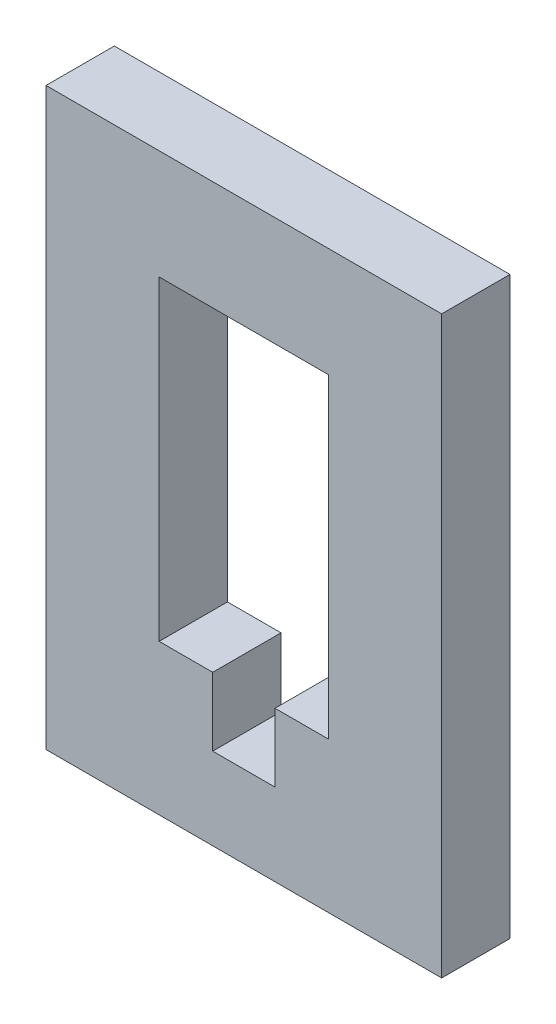
from build123d import *

# Parameters (mm, degrees)
SKETCH1_W           = 28.96
SKETCH1_H           = 11
BOSS_EXTRUDE1_DEPTH = 5
SKETCH2_W           = 8.28
SKETCH2_H           = 5
BOSS_EXTRUDE2_DEPTH = 23.1
SKETCH3_W           = 28.96
SKETCH3_H           = 5
BOSS_EXTRUDE3_DEPTH = 8
SKETCH4_W           = 4.56
SKETCH4_H           = 5
CUT_EXTRUDE1_DEPTH  = 5


with BuildPart() as part:
    # Sketch1 → Boss-Extrude1 (new body)
    with BuildSketch(Plane.XY):
        with Locations((-4.078230088, 25.589734513)):
            Rectangle(SKETCH1_W, SKETCH1_H)
    extrude(amount=BOSS_EXTRUDE1_DEPTH)

    # Sketch2 → Boss-Extrude2 (add)
    with BuildSketch(Plane(origin=(0, 31.089734513, 0), x_dir=(1, 0, 0), z_dir=(0, 1, 0))):
        with Locations((-14.418230088, -2.5)):
            Rectangle(SKETCH2_W, SKETCH2_H)
        with Locations((6.261769912, -2.5)):
            Rectangle(SKETCH2_W, SKETCH2_H)
    extrude(amount=BOSS_EXTRUDE2_DEPTH)

    # Sketch3 → Boss-Extrude3 (add)
    with BuildSketch(Plane(origin=(0, 54.189734513, 0), x_dir=(1, 0, 0), z_dir=(0, 1, 0))):
        with Locations((-4.078230088, -2.5)):
            Rectangle(SKETCH3_W, SKETCH3_H)
    extrude(amount=BOSS_EXTRUDE3_DEPTH)

    # Sketch4 → Cut-Extrude1 (cut)
    with BuildSketch(Plane(origin=(0, 31.089734513, 0), x_dir=(1, 0, 0), z_dir=(0, 1, 0))):
        with Locations((-4.078230088, -2.5)):
            Rectangle(SKETCH4_W, SKETCH4_H)
    extrude(amount=-CUT_EXTRUDE1_DEPTH, mode=Mode.SUBTRACT)


solid = part.part
